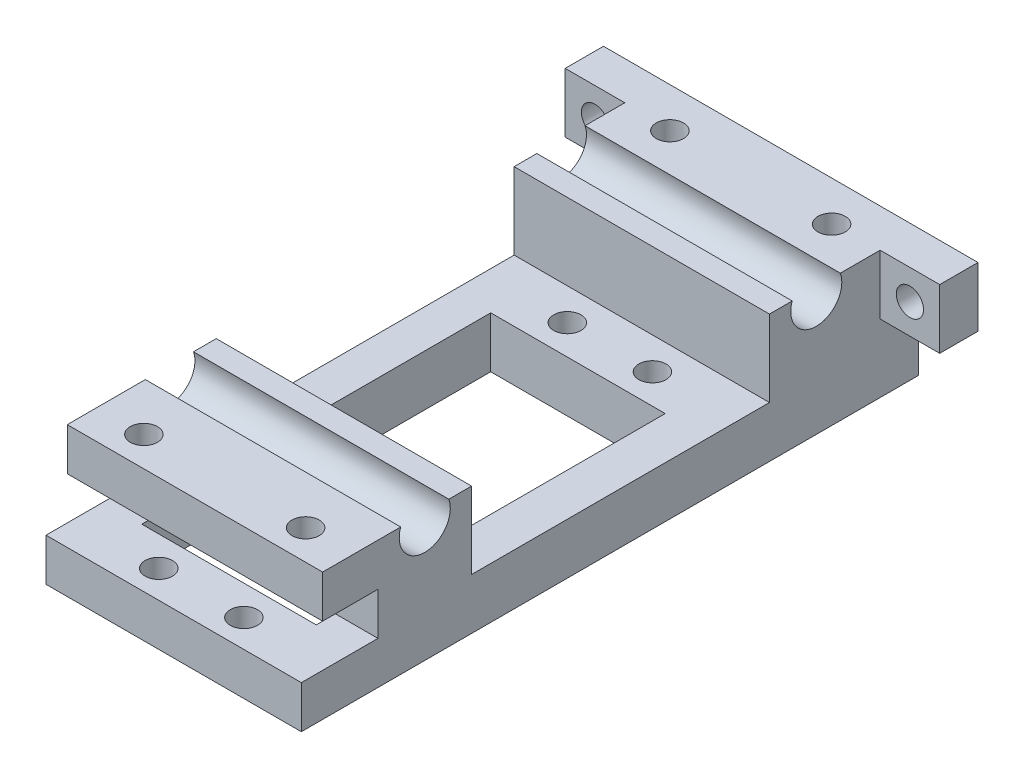
from build123d import *

# Parameters (mm, degrees)
SKETCH1_W           = 30
SKETCH1_H           = 72.5
BOSS_EXTRUDE1_DEPTH = 15
SKETCH2_W           = 20.5
SKETCH2_H           = 41
CUT_EXTRUDE1_DEPTH  = 8
SKETCH3_W           = 30
SKETCH3_H           = 35
CUT_EXTRUDE2_DEPTH  = 9
CUT_EXTRUDE3_DEPTH  = 50.386865663
CUT_EXTRUDE4_REACH  = 44.001
SKETCH5_R           = 1.6
SKETCH6_R           = 3
CUT_EXTRUDE5_DEPTH  = 50.386865663
CUT_EXTRUDE6_REACH  = 44.001
SKETCH7_R           = 1.6
SKETCH8_W           = 7
SKETCH8_H           = 7
BOSS_EXTRUDE2_DEPTH = 4.5
CUT_EXTRUDE7_REACH  = 79.235
SKETCH9_R           = 1.6


with BuildPart() as part:
    # Sketch1 → Boss-Extrude1 (new body)
    with BuildSketch(Plane(origin=(0, 0, 0), x_dir=(1, 0, 0), z_dir=(0, 1, 0))):
        Rectangle(SKETCH1_W, SKETCH1_H)
    extrude(amount=BOSS_EXTRUDE1_DEPTH)

    # Sketch2 → Cut-Extrude1 (cut)
    with BuildSketch(Plane.XZ):
        with Locations((-0.25, 9)):
            Rectangle(SKETCH2_W, SKETCH2_H)
    extrude(amount=-CUT_EXTRUDE1_DEPTH, mode=Mode.SUBTRACT)

    # Sketch3 → Cut-Extrude2 (cut)
    with BuildSketch(Plane(origin=(0, 15, 0), x_dir=(1, 0, 0), z_dir=(0, 1, 0))):
        with Locations((0, 1.25)):
            Rectangle(SKETCH3_W, SKETCH3_H)
    extrude(amount=-CUT_EXTRUDE2_DEPTH, mode=Mode.SUBTRACT)

    # Sketch4 → Cut-Extrude3 (cut, through all)
    with BuildSketch(Plane(origin=(15, 0, 0), x_dir=(0, 0, -1), z_dir=(1, 0, 0))):
        Polygon((-33.75, 15), (-33.75, 10), (-27.25, 10), (-27.25, 5), (-36.25, 5), (-36.25, 15), align=None)
    extrude(amount=-CUT_EXTRUDE3_DEPTH, mode=Mode.SUBTRACT)

    # Sketch5 → Cut-Extrude4 (cut, up to next)
    with BuildSketch(Plane.XZ, mode=Mode.PRIVATE) as cut_extrude4_sk1:
        with Locations(Location((-5, 33, 0), (0, 0, 270))):
            Circle(SKETCH5_R)
    cut_extrude4_tool1 = extrude(cut_extrude4_sk1.sketch, amount=-CUT_EXTRUDE4_REACH, mode=Mode.PRIVATE) & part.part
    # Sketch5 → Cut-Extrude4 (cut, up to next)
    with BuildSketch(Plane.XZ, mode=Mode.PRIVATE) as cut_extrude4_sk2:
        with Locations(Location((5, 33, 0), (0, 0, 270))):
            Circle(SKETCH5_R)
    cut_extrude4_tool2 = extrude(cut_extrude4_sk2.sketch, amount=-CUT_EXTRUDE4_REACH, mode=Mode.PRIVATE) & part.part
    # Sketch5 → Cut-Extrude4 (cut, up to next)
    with BuildSketch(Plane.XZ, mode=Mode.PRIVATE) as cut_extrude4_sk3:
        with Locations(Location((-5, -15, 0), (0, 0, 270))):
            Circle(SKETCH5_R)
    cut_extrude4_tool3 = extrude(cut_extrude4_sk3.sketch, amount=-CUT_EXTRUDE4_REACH, mode=Mode.PRIVATE) & part.part
    # Sketch5 → Cut-Extrude4 (cut, up to next)
    with BuildSketch(Plane.XZ, mode=Mode.PRIVATE) as cut_extrude4_sk4:
        with Locations(Location((5, -15, 0), (0, 0, 270))):
            Circle(SKETCH5_R)
    cut_extrude4_tool4 = extrude(cut_extrude4_sk4.sketch, amount=-CUT_EXTRUDE4_REACH, mode=Mode.PRIVATE) & part.part
    add(cut_extrude4_tool1.solids().sort_by_distance((-5, 0, 33))[0], mode=Mode.SUBTRACT)
    add(cut_extrude4_tool2.solids().sort_by_distance((5, 0, 33))[0], mode=Mode.SUBTRACT)
    add(cut_extrude4_tool3.solids().sort_by_distance((-5, 0, -15))[0], mode=Mode.SUBTRACT)
    add(cut_extrude4_tool4.solids().sort_by_distance((5, 0, -15))[0], mode=Mode.SUBTRACT)

    # Sketch6 → Cut-Extrude5 (cut, through all)
    with BuildSketch(Plane(origin=(15, 0, 0), x_dir=(0, 0, -1), z_dir=(1, 0, 0))):
        with Locations((24.25, 14)):
            Circle(SKETCH6_R)
        with Locations((-21.75, 14)):
            Circle(SKETCH6_R)
    extrude(amount=-CUT_EXTRUDE5_DEPTH, mode=Mode.SUBTRACT)

    # Sketch7 → Cut-Extrude6 (cut, up to next)
    with BuildSketch(Plane(origin=(0, 15, 0), x_dir=(1, 0, 0), z_dir=(0, 1, 0)), mode=Mode.PRIVATE) as cut_extrude6_sk1:
        with Locations(Location((-9.5, -30.25, 0), (0, 0, 270))):
            Circle(SKETCH7_R)
    cut_extrude6_tool1 = extrude(cut_extrude6_sk1.sketch, amount=-CUT_EXTRUDE6_REACH, mode=Mode.PRIVATE) & part.part
    # Sketch7 → Cut-Extrude6 (cut, up to next)
    with BuildSketch(Plane(origin=(0, 15, 0), x_dir=(1, 0, 0), z_dir=(0, 1, 0)), mode=Mode.PRIVATE) as cut_extrude6_sk2:
        with Locations(Location((9.5, -30.25, 0), (0, 0, 270))):
            Circle(SKETCH7_R)
    cut_extrude6_tool2 = extrude(cut_extrude6_sk2.sketch, amount=-CUT_EXTRUDE6_REACH, mode=Mode.PRIVATE) & part.part
    # Sketch7 → Cut-Extrude6 (cut, up to next)
    with BuildSketch(Plane(origin=(0, 15, 0), x_dir=(1, 0, 0), z_dir=(0, 1, 0)), mode=Mode.PRIVATE) as cut_extrude6_sk3:
        with Locations(Location((-9.5, 31.55, 0), (0, 0, 270))):
            Circle(SKETCH7_R)
    cut_extrude6_tool3 = extrude(cut_extrude6_sk3.sketch, amount=-CUT_EXTRUDE6_REACH, mode=Mode.PRIVATE) & part.part
    # Sketch7 → Cut-Extrude6 (cut, up to next)
    with BuildSketch(Plane(origin=(0, 15, 0), x_dir=(1, 0, 0), z_dir=(0, 1, 0)), mode=Mode.PRIVATE) as cut_extrude6_sk4:
        with Locations(Location((9.5, 31.55, 0), (0, 0, 270))):
            Circle(SKETCH7_R)
    cut_extrude6_tool4 = extrude(cut_extrude6_sk4.sketch, amount=-CUT_EXTRUDE6_REACH, mode=Mode.PRIVATE) & part.part
    add(cut_extrude6_tool1.solids().sort_by_distance((-9.5, 15, 30.25))[0], mode=Mode.SUBTRACT)
    add(cut_extrude6_tool2.solids().sort_by_distance((9.5, 15, 30.25))[0], mode=Mode.SUBTRACT)
    add(cut_extrude6_tool3.solids().sort_by_distance((-9.5, 15, -31.55))[0], mode=Mode.SUBTRACT)
    add(cut_extrude6_tool4.solids().sort_by_distance((9.5, 15, -31.55))[0], mode=Mode.SUBTRACT)

    # Sketch8 → Boss-Extrude2 (add)
    with BuildSketch(Plane(origin=(0, 0, -36.25), x_dir=(-1, 0, 0), z_dir=(0, 0, -1))):
        with Locations((18.5, 11.5)):
            Rectangle(SKETCH8_W, SKETCH8_H)
        with Locations((-18.5, 11.5)):
            Rectangle(SKETCH8_W, SKETCH8_H)
    extrude(amount=-BOSS_EXTRUDE2_DEPTH)

    # Sketch9 → Cut-Extrude7 (cut, up to next)
    with BuildSketch(Plane(origin=(0, 0, -36.25), x_dir=(-1, 0, 0), z_dir=(0, 0, -1)), mode=Mode.PRIVATE) as cut_extrude7_sk1:
        with Locations((18.5, 11.5)):
            Circle(SKETCH9_R)
    cut_extrude7_tool1 = extrude(cut_extrude7_sk1.sketch, amount=-CUT_EXTRUDE7_REACH, mode=Mode.PRIVATE) & part.part
    # Sketch9 → Cut-Extrude7 (cut, up to next)
    with BuildSketch(Plane(origin=(0, 0, -36.25), x_dir=(-1, 0, 0), z_dir=(0, 0, -1)), mode=Mode.PRIVATE) as cut_extrude7_sk2:
        with Locations((-18.5, 11.5)):
            Circle(SKETCH9_R)
    cut_extrude7_tool2 = extrude(cut_extrude7_sk2.sketch, amount=-CUT_EXTRUDE7_REACH, mode=Mode.PRIVATE) & part.part
    add(cut_extrude7_tool1.solids().sort_by_distance((-18.5, 11.5, -36.25))[0], mode=Mode.SUBTRACT)
    add(cut_extrude7_tool2.solids().sort_by_distance((18.5, 11.5, -36.25))[0], mode=Mode.SUBTRACT)


solid = part.part
